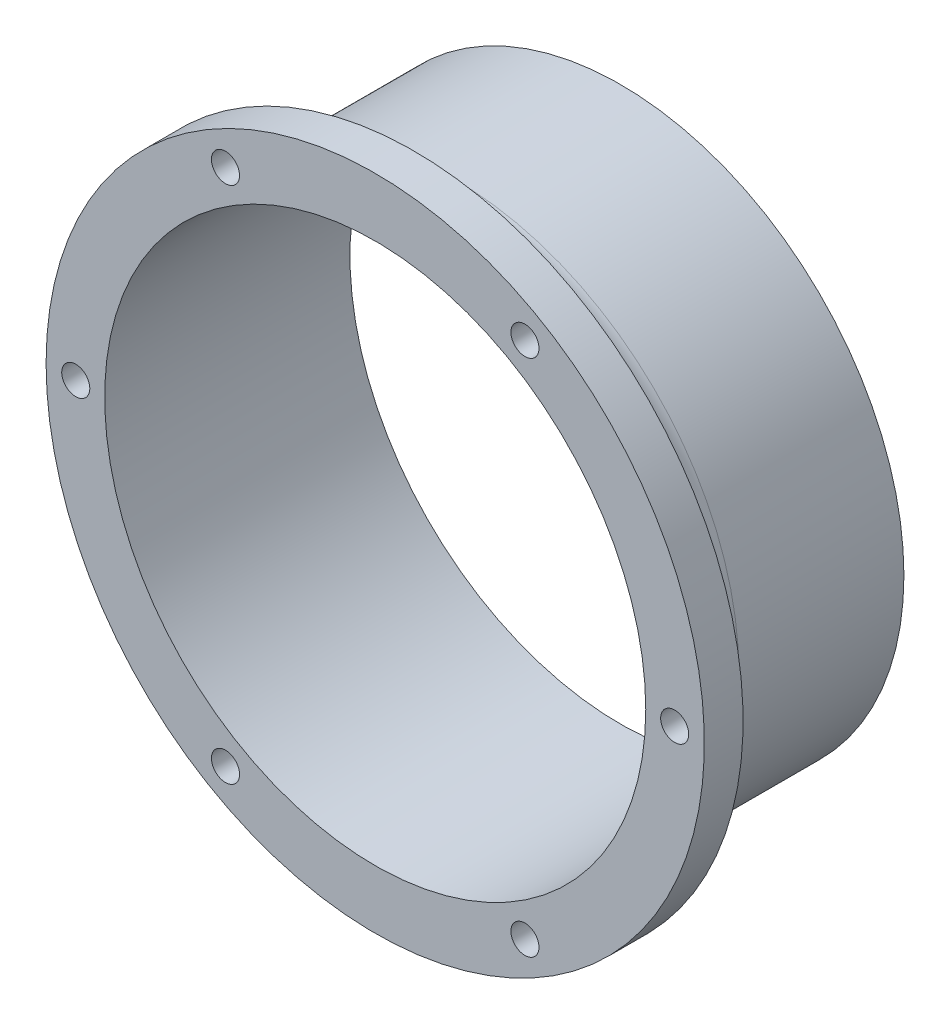
from build123d import *

# Parameters (mm, degrees)
SKETCH1_R           = 34.8615
SKETCH1_R_2         = 33.274
BOSS_EXTRUDE1_DEPTH = 25.4
SKETCH2_R           = 40.48125
SKETCH2_R_2         = 33.274
BOSS_EXTRUDE2_DEPTH = 4.7625
FILLET1_R           = 5.08
CIRPATTERN1_COUNT   = 6


with BuildPart() as part:
    # Sketch1 → Boss-Extrude1 (new body)
    with BuildSketch(Plane.XY):
        Circle(SKETCH1_R)
        Circle(SKETCH1_R_2, mode=Mode.SUBTRACT)
    extrude(amount=BOSS_EXTRUDE1_DEPTH)

    # Sketch2 → Boss-Extrude2 (add)
    with BuildSketch(Plane.XY.offset(25.4)):
        with Locations(Location((0, 0, 0), (0, 0, 180))):
            Circle(SKETCH2_R)
        Circle(SKETCH2_R_2, mode=Mode.SUBTRACT)
    extrude(amount=BOSS_EXTRUDE2_DEPTH)

    # Fillet1
    fillet1_edges = [part.edges().sort_by_distance(p)[0] for p in [
        (-34.8615, 0, 25.4),
    ]]
    fillet(fillet1_edges, radius=FILLET1_R)

    # Sketch7 → #8-32 Tapped Hole1 (revolve, cut)
    with BuildSketch(Plane(origin=(-18.415, 31.895715621, 30.1625), x_dir=(0, -1, 0), z_dir=(1, 0, 0))):
        Polygon((0, 0), (0, 11.705806461), (1.7272, 10.668), (1.7272, 0), align=None)
    f_8_32_tapped_hole1 = revolve(axis=Axis((-18.415, 31.895715621, 36.5125), (0, 0, -1)), mode=Mode.SUBTRACT)

    # CirPattern1: #8-32 Tapped Hole1 ×6 about axis
    cirpattern1_axis = Axis((0, 0, 0), (0, 0, 1))
    for i in range(1, CIRPATTERN1_COUNT):
        add(f_8_32_tapped_hole1.rotate(cirpattern1_axis, i * 360 / CIRPATTERN1_COUNT), mode=Mode.SUBTRACT)


solid = part.part
